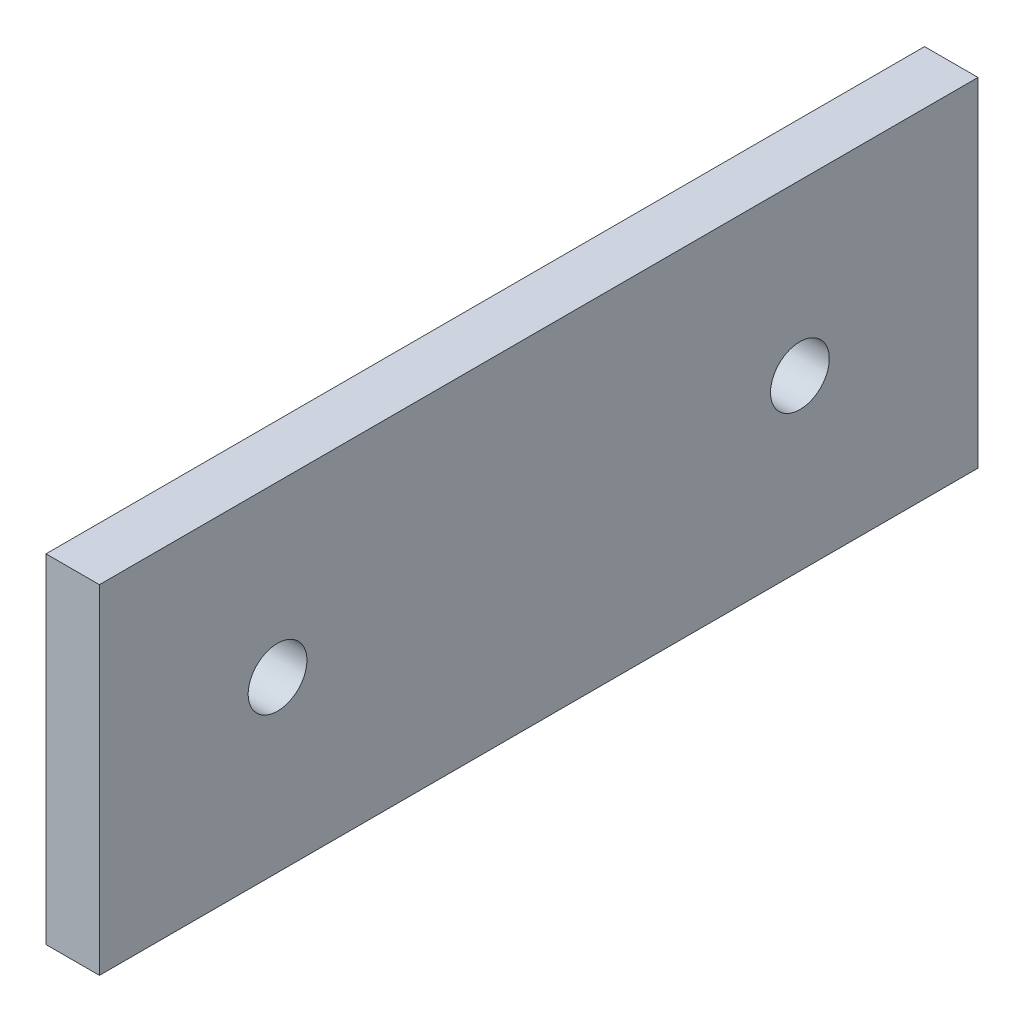
from build123d import *

# Parameters (mm, degrees)
SKETCH_1_W          = 19
SKETCH_1_H          = 19
SKETCH_1_W_2        = 13
SKETCH_1_H_2        = 13
EXTRUDE_1_DEPTH     = 49.33
SKETCH_2_R          = 1.65
CUT_EXTRUDE_1_DEPTH = 30
SKETCH_3_W          = 49.33
SKETCH_3_H          = 19
CUT_EXTRUDE_2_DEPTH = 16


with BuildPart() as part:
    # 草图1 → Extrude 1 (new body)
    with BuildSketch(Plane.XY):
        with Locations((6.5, 6.5)):
            Rectangle(SKETCH_1_W, SKETCH_1_H)
        with Locations((6.5, 6.5)):
            Rectangle(SKETCH_1_W_2, SKETCH_1_H_2, mode=Mode.SUBTRACT)
    extrude(amount=EXTRUDE_1_DEPTH)

    # 草图2 → 切除-拉伸1 (cut)
    with BuildSketch(Plane.ZY.offset(3)):
        with Locations((10, 6.5)):
            Circle(SKETCH_2_R)
        with Locations((39.33, 6.5)):
            Circle(SKETCH_2_R)
    extrude(amount=-CUT_EXTRUDE_1_DEPTH, mode=Mode.SUBTRACT)

    # 草图3 → 切除-拉伸2 (cut)
    with BuildSketch(Plane(origin=(16, 0, 0), x_dir=(0, 0, -1), z_dir=(1, 0, 0))):
        with Locations((-24.665, 6.5)):
            Rectangle(SKETCH_3_W, SKETCH_3_H)
    extrude(amount=-CUT_EXTRUDE_2_DEPTH, mode=Mode.SUBTRACT)


solid = part.part
